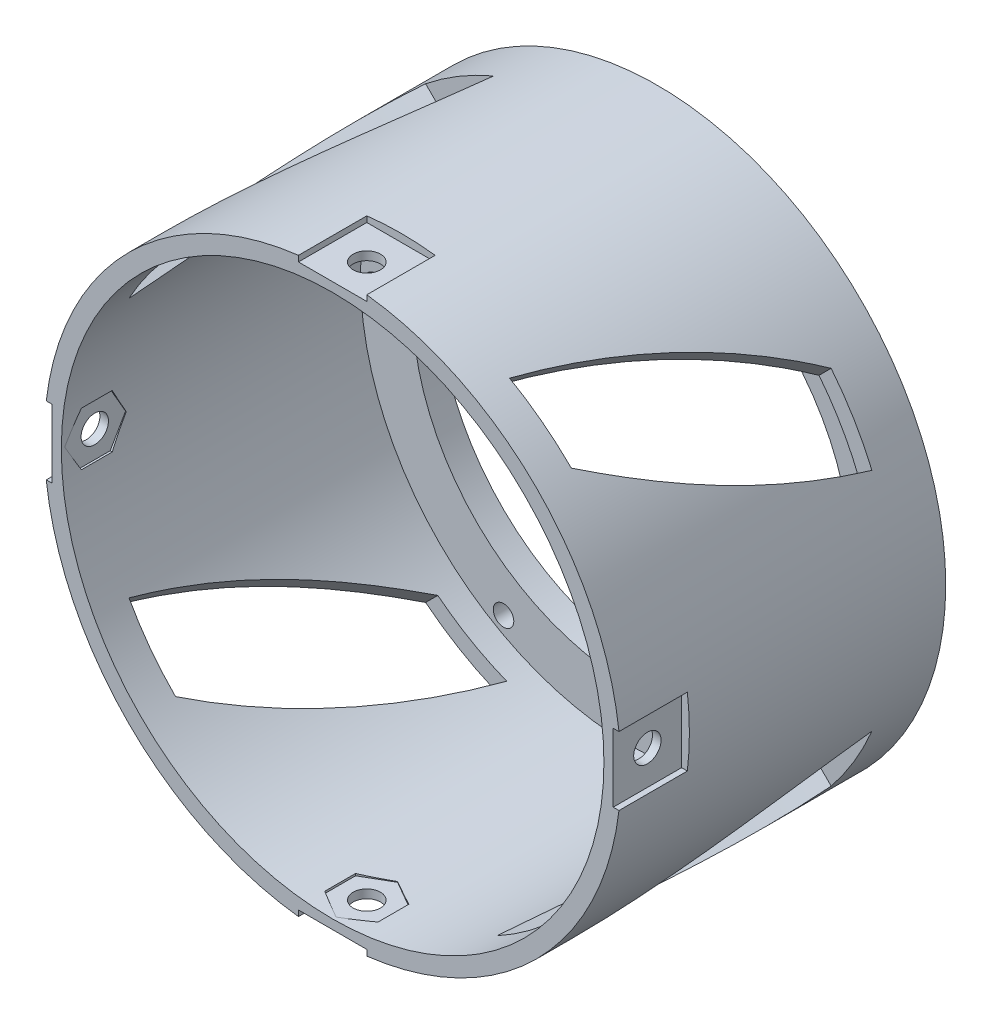
from build123d import *

# Parameters (mm, degrees)
SKETCH2_R           = 42.8622
SKETCH2_R_2         = 32.562372804
SKETCH2_R_3         = 1.524
BOSS_EXTRUDE1_DEPTH = 3.81
SKETCH3_R           = 42.8622
SKETCH3_R_2         = 40.3222
BOSS_EXTRUDE2_DEPTH = 44.45
SKETCH7_W           = 2.674266908
SKETCH7_H           = 10.16
SKETCH7_W_2         = 10.16
SKETCH7_H_2         = 2.674266908
CUT_EXTRUDE2_DEPTH  = 10.16
CUT_EXTRUDE3_DEPTH  = 10.16
SKETCH9_R           = 2.032
CUT_EXTRUDE4_DEPTH  = 10.16
CIRPATTERN2_COUNT   = 4
CUT_EXTRUDE5_DEPTH  = 78.481378264
CIRPATTERN3_COUNT   = 2
CIRPATTERN3_ANGLE   = 90


with BuildPart() as part:
    # Sketch2 → Boss-Extrude1 (new body)
    with BuildSketch(Plane.XY):
        Circle(SKETCH2_R)
        Circle(SKETCH2_R_2, mode=Mode.SUBTRACT)
        with Locations((-19.05, 32.995567884)):
            Circle(SKETCH2_R_3, mode=Mode.SUBTRACT)
        with Locations((-38.1, 0)):
            Circle(SKETCH2_R_3, mode=Mode.SUBTRACT)
        with Locations((-19.05, -32.995567884)):
            Circle(SKETCH2_R_3, mode=Mode.SUBTRACT)
        with Locations((19.05, -32.995567884)):
            Circle(SKETCH2_R_3, mode=Mode.SUBTRACT)
        with Locations((38.1, 0)):
            Circle(SKETCH2_R_3, mode=Mode.SUBTRACT)
        with Locations((19.05, 32.995567884)):
            Circle(SKETCH2_R_3, mode=Mode.SUBTRACT)
    extrude(amount=BOSS_EXTRUDE1_DEPTH)

    # Sketch3 → Boss-Extrude2 (add)
    with BuildSketch(Plane.XY.offset(3.81)):
        Circle(SKETCH3_R)
        Circle(SKETCH3_R_2, mode=Mode.SUBTRACT)
    extrude(amount=BOSS_EXTRUDE2_DEPTH)

    # Sketch7 → Cut-Extrude2 (cut)
    with BuildSketch(Plane.XY.offset(48.26)):
        with Locations((43.037064748, 0)):
            Rectangle(SKETCH7_W, SKETCH7_H)
        with Locations((0, -43.037064748)):
            Rectangle(SKETCH7_W_2, SKETCH7_H_2)
        with Locations((-43.037064748, 0)):
            Rectangle(SKETCH7_W, SKETCH7_H)
        with Locations((0, 43.037064748)):
            Rectangle(SKETCH7_W_2, SKETCH7_H_2)
    extrude(amount=-CUT_EXTRUDE2_DEPTH, mode=Mode.SUBTRACT)

    # Sketch8 → Cut-Extrude3 (cut)
    with BuildSketch(Plane(origin=(40.429931294, 0, 0), x_dir=(0, 0, -1), z_dir=(1, 0, 0))):
        Polygon((-38.604614587, 0), (-40.892307293, 3.9624), (-45.467692707, 3.9624), (-47.755385413, 0), (-45.467692707, -3.9624), (-40.892307293, -3.9624), align=None)
    cut_extrude3 = extrude(amount=-CUT_EXTRUDE3_DEPTH, mode=Mode.SUBTRACT)

    # Sketch9 → Cut-Extrude4 (cut)
    with BuildSketch(Plane(origin=(41.699931294, 0, 0), x_dir=(0, 0, -1), z_dir=(1, 0, 0))):
        with Locations((-43.18, 0)):
            Circle(SKETCH9_R)
    cut_extrude4 = extrude(amount=-CUT_EXTRUDE4_DEPTH, mode=Mode.SUBTRACT)

    # CirPattern2: Cut-Extrude3, Cut-Extrude4 ×4 about axis
    cirpattern2_axis = Axis((0, 0, 48.26), (0, 0, 1))
    add([cut_extrude3.rotate(cirpattern2_axis, i * 360 / CIRPATTERN2_COUNT) for i in range(1, CIRPATTERN2_COUNT)], mode=Mode.SUBTRACT)
    add([cut_extrude4.rotate(cirpattern2_axis, i * 360 / CIRPATTERN2_COUNT) for i in range(1, CIRPATTERN2_COUNT)], mode=Mode.SUBTRACT)

    # Sketch10 → Cut-Extrude5 (cut, symmetric)
    with BuildSketch(Plane(origin=(0, 0, 0), x_dir=(0, 0, 1), z_dir=(0.7071067811865464, 0.7071067811865488, 0))):
        with BuildLine():
            Line((7.547865198, 16.021870477), (7.547865198, 4.591870477))
            add(Edge.make_bspline(
                [(7.547865198, 4.591870477), (23.63247535, -7.228573119), (43.107865198, -11.410129523)],
                knots=[0, 0, 0, 1, 1, 1], degree=2))
            Line((43.107865198, -11.410129523), (43.107865198, 0.019870477))
            add(Edge.make_bspline(
                [(7.547865198, 16.021870477), (26.879831208, 11.531662429), (43.107865198, 0.019870477)],
                knots=[0, 0, 0, 1, 1, 1], degree=2))
        make_face()
    cut_extrude5 = extrude(amount=CUT_EXTRUDE5_DEPTH, both=True, mode=Mode.SUBTRACT)

    # CirPattern3: Cut-Extrude5 ×2 about axis
    cirpattern3_axis = Axis((0, 0, 48.26), (0, 0, 1))
    for i in range(1, CIRPATTERN3_COUNT):
        add(cut_extrude5.rotate(cirpattern3_axis, i * CIRPATTERN3_ANGLE / (CIRPATTERN3_COUNT - 1)), mode=Mode.SUBTRACT)


solid = part.part
